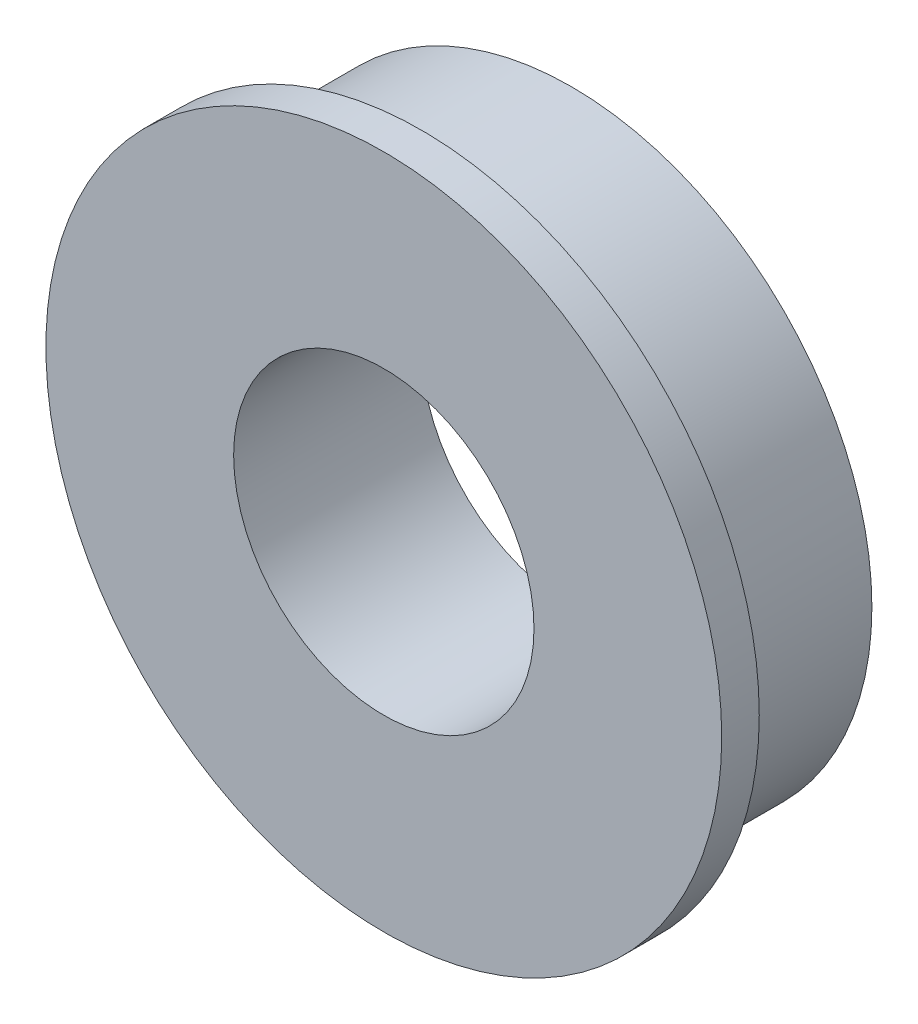
from build123d import *

# Parameters (mm, degrees)
SKETCH1_R           = 8
SKETCH1_R_2         = 4
BOSS_EXTRUDE1_DEPTH = 5
BOSS_EXTRUDE2_START = -1
SKETCH2_R           = 9
SKETCH2_R_2         = 4
BOSS_EXTRUDE2_DEPTH = 1


with BuildPart() as part:
    # Sketch1 → Boss-Extrude1 (new body)
    with BuildSketch(Plane.XY):
        Circle(SKETCH1_R)
        Circle(SKETCH1_R_2, mode=Mode.SUBTRACT)
    extrude(amount=BOSS_EXTRUDE1_DEPTH)

    # Sketch2 → Boss-Extrude2 (add)
    with BuildSketch(Plane.XY.offset(5).offset(BOSS_EXTRUDE2_START)):
        Circle(SKETCH2_R)
        Circle(SKETCH2_R_2, mode=Mode.SUBTRACT)
    extrude(amount=BOSS_EXTRUDE2_DEPTH)


solid = part.part
